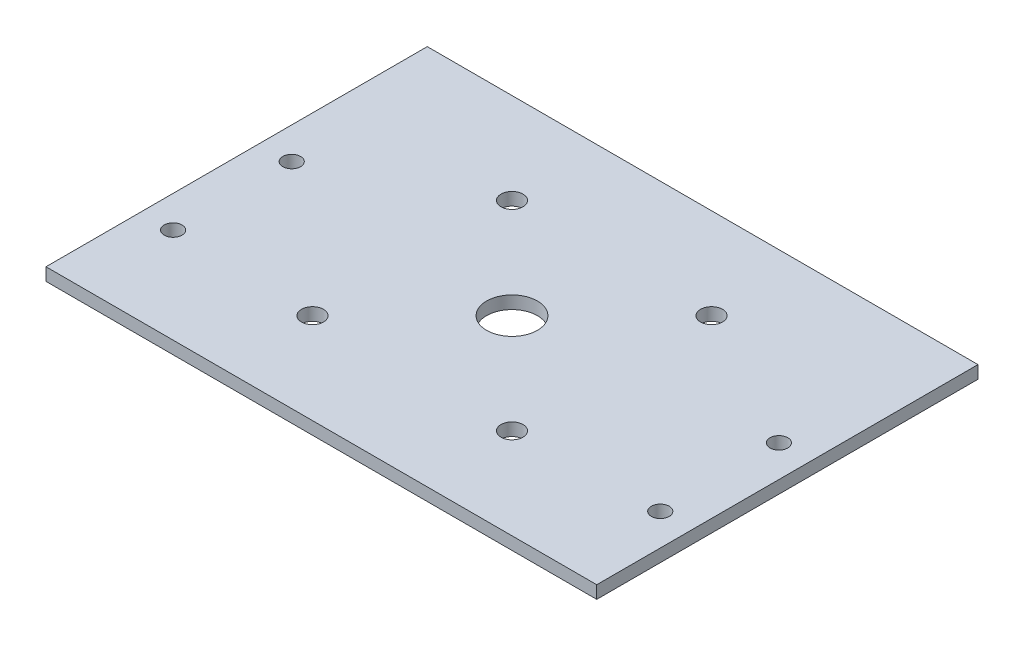
from build123d import *

# Parameters (mm, degrees)
SKETCH1_W           = 130
SKETCH1_H           = 90
BOSS_EXTRUDE1_DEPTH = 3
SKETCH2_R           = 2.6
CUT_EXTRUDE1_DEPTH  = 10
SKETCH3_R           = 2.1
CUT_EXTRUDE2_DEPTH  = 10
SKETCH4_R           = 6
CUT_EXTRUDE3_DEPTH  = 10


with BuildPart() as part:
    # Sketch1 → Boss-Extrude1 (new body)
    with BuildSketch(Plane(origin=(0, 0, 0), x_dir=(1, 0, 0), z_dir=(0, 1, 0))):
        Rectangle(SKETCH1_W, SKETCH1_H)
    extrude(amount=BOSS_EXTRUDE1_DEPTH)

    # Sketch2 → Cut-Extrude1 (cut)
    with BuildSketch(Plane(origin=(0, 3, 0), x_dir=(1, 0, 0), z_dir=(0, 1, 0))):
        with Locations(Location((23.55, -23.55, 0), (0, 0, 270))):
            Circle(SKETCH2_R)
        with Locations(Location((-23.55, -23.55, 0), (0, 0, 270))):
            Circle(SKETCH2_R)
        with Locations(Location((-23.55, 23.55, 0), (0, 0, 270))):
            Circle(SKETCH2_R)
        with Locations(Location((23.55, 23.55, 0), (0, 0, 270))):
            Circle(SKETCH2_R)
    extrude(amount=-CUT_EXTRUDE1_DEPTH, mode=Mode.SUBTRACT)

    # Sketch3 → Cut-Extrude2 (cut)
    with BuildSketch(Plane.XZ):
        with Locations(Location((57.5, 22.5, 0), (0, 0, 270))):
            Circle(SKETCH3_R)
        with Locations(Location((-57.5, 22.5, 0), (0, 0, 270))):
            Circle(SKETCH3_R)
        with Locations(Location((-57.5, -5.5, 0), (0, 0, 270))):
            Circle(SKETCH3_R)
        with Locations(Location((57.5, -5.5, 0), (0, 0, 270))):
            Circle(SKETCH3_R)
    extrude(amount=-CUT_EXTRUDE2_DEPTH, mode=Mode.SUBTRACT)

    # Sketch4 → Cut-Extrude3 (cut)
    with BuildSketch(Plane.XZ):
        with Locations(Location((0, 0, 0), (0, 0, 270))):
            Circle(SKETCH4_R)
    extrude(amount=-CUT_EXTRUDE3_DEPTH, mode=Mode.SUBTRACT)


solid = part.part
